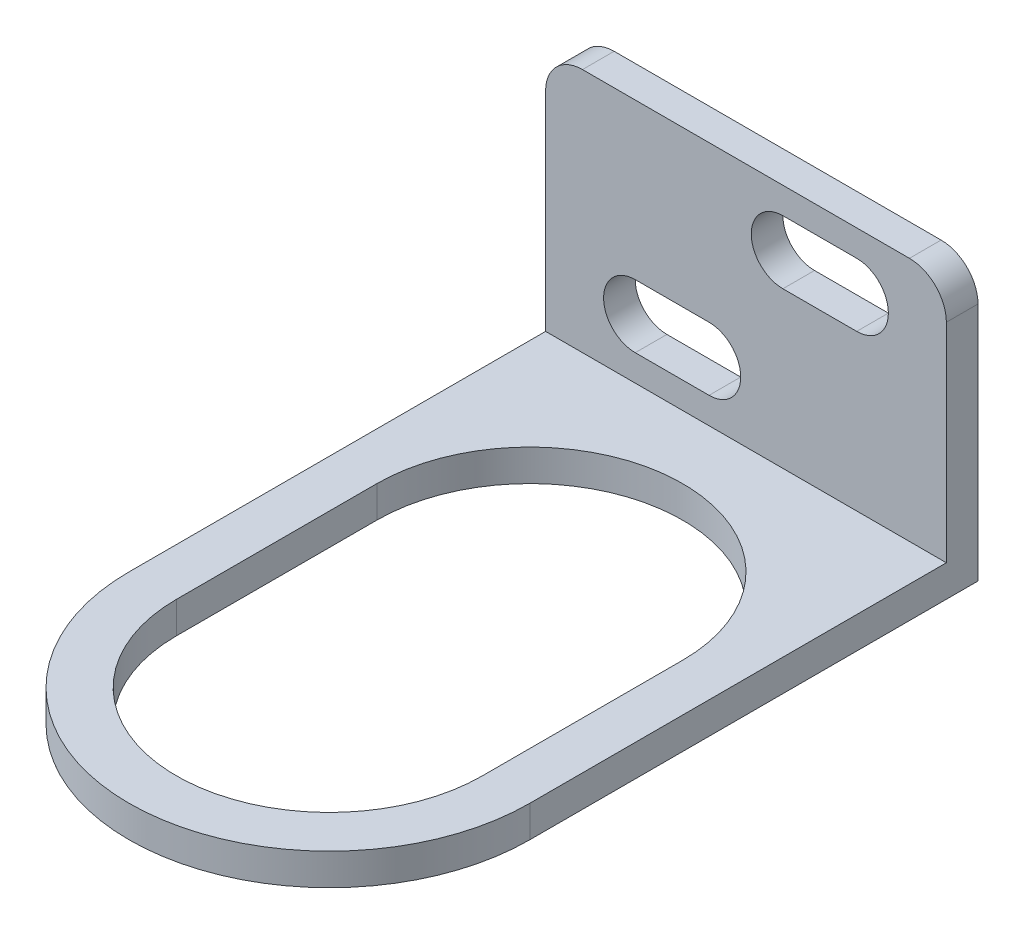
from build123d import *

# Parameters (mm, degrees)
EXTRUDE_THIN1_DEPTH = 38
CUT_EXTRUDE1_DEPTH  = 76.716989507
FILLET1_R           = 3.5
FILLET2_R           = 3.5
CUT_EXTRUDE2_DEPTH  = 78.159331905


with BuildPart() as part:
    # Sketch2 → Extrude-Thin1 (new body)
    with BuildSketch(Plane(origin=(0, 0, 0), x_dir=(0, 0, -1), z_dir=(1, 0, 0))):
        Polygon((-63, 0), (0, 0), (0, 26.25), (-3, 26.25), (-3, 3), (-63, 3), align=None)
    extrude(amount=-EXTRUDE_THIN1_DEPTH)

    # Sketch3 → Cut-Extrude1 (cut, through all)
    with BuildSketch(Plane.XY.offset(3)):
        with BuildLine():
            Line((-29.5, 11.5), (-22.5, 11.5))
            ThreePointArc((-22.5, 11.5), (-19.5, 8.5), (-22.5, 5.5))
            Line((-22.5, 5.5), (-29.5, 5.5))
            ThreePointArc((-29.5, 5.5), (-32.5, 8.5), (-29.5, 11.5))
        make_face()
        with BuildLine():
            Line((-15.5, 23.75), (-8.5, 23.75))
            ThreePointArc((-8.5, 23.75), (-5.5, 20.75), (-8.5, 17.75))
            Line((-8.5, 17.75), (-15.5, 17.75))
            ThreePointArc((-15.5, 17.75), (-18.5, 20.75), (-15.5, 23.75))
        make_face()
    extrude(amount=-CUT_EXTRUDE1_DEPTH, mode=Mode.SUBTRACT)

    # Fillet1
    fillet1_edges = [part.edges().sort_by_distance(p)[0] for p in [
        (-38, 26.25, 1.5),
    ]]
    fillet(fillet1_edges, radius=FILLET1_R)

    # Fillet2
    fillet2_edges = [part.edges().sort_by_distance(p)[0] for p in [
        (0, 26.25, 1.5),
    ]]
    fillet(fillet2_edges, radius=FILLET2_R)

    # Sketch4 → Cut-Extrude2 (cut, through all)
    with BuildSketch(Plane(origin=(0, 3, 0), x_dir=(1, 0, 0), z_dir=(0, 1, 0))):
        with BuildLine():
            Line((-33.5, -23.5), (-33.5, -42.5))
            ThreePointArc((-33.5, -42.5), (-19, -57), (-4.5, -42.5))
            Line((-4.5, -42.5), (-4.5, -23.5))
            ThreePointArc((-4.5, -23.5), (-19, -9), (-33.5, -23.5))
        make_face()
        with BuildLine():
            Line((0, -63), (0, -42.5))
            ThreePointArc((0, -42.5), (-19, -61.5), (-38, -42.5))
            Line((-38, -42.5), (-38, -63))
            Line((-38, -63), (0, -63))
        make_face()
    extrude(amount=-CUT_EXTRUDE2_DEPTH, mode=Mode.SUBTRACT)


solid = part.part
